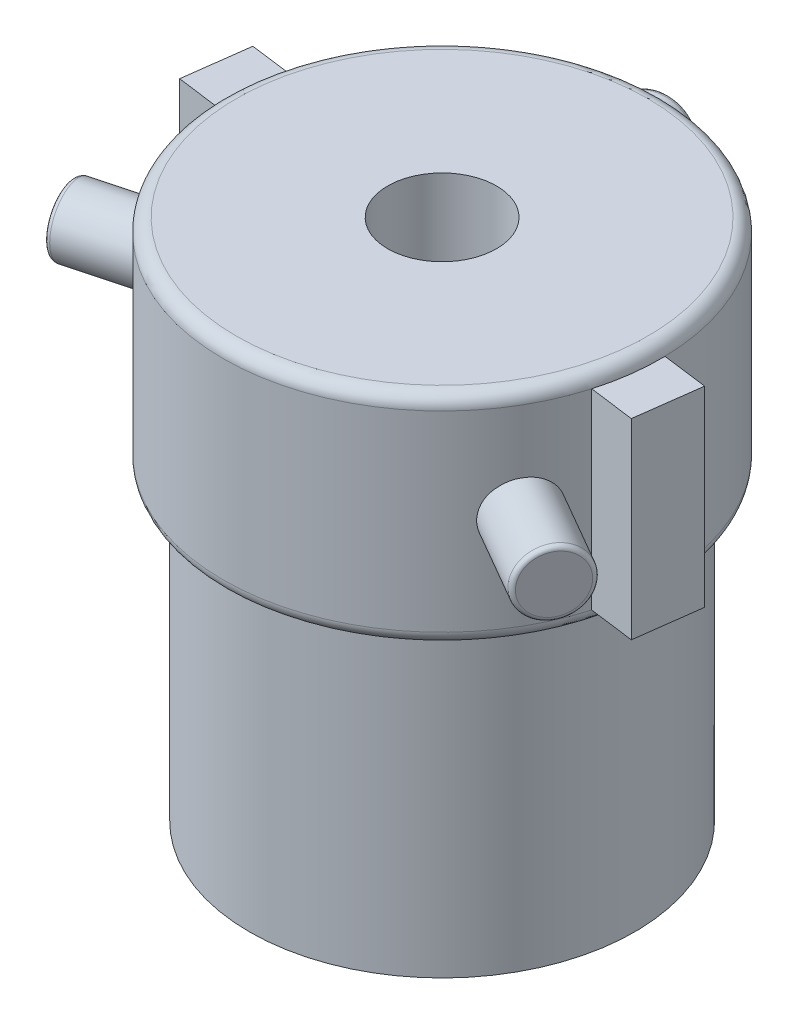
from build123d import *

# Parameters (mm, degrees)
SKETCH1_R                = 44.25
BOSS_EXTRUDE1_DEPTH      = 70
SKETCH2_R                = 50.25
BOSS_EXTRUDE2_DEPTH      = 50
SKETCH3_R                = 12.5
CUT_EXTRUDE1_DEPTH       = 120
FILLET1_R                = 3
FILLET2_R                = 3
BOSS_EXTRUDE3_DEPTH      = 20
BOSS_EXTRUDE3_DEPTH_BACK = 3
SKETCH5_R                = 7.5
CIRPATTERN2_COUNT        = 2
CIRPATTERN2_ANGLE        = 135
BOSS_EXTRUDE7_DEPTH      = 20
BOSS_EXTRUDE7_DEPTH_BACK = 3
SKETCH9_R                = 7.5
FILLET4_R                = 1
FILLET5_R                = 1
FILLET6_R                = 1
BOSS_EXTRUDE8_DEPTH      = 10
BOSS_EXTRUDE8_DEPTH_BACK = 10
SKETCH10_W               = 15
SKETCH10_H               = 44
BOSS_EXTRUDE9_DEPTH      = 10
BOSS_EXTRUDE9_DEPTH_BACK = 10
SKETCH11_W               = 15
SKETCH11_H               = 44
CIRPATTERN4_COUNT        = 2
CIRPATTERN4_ANGLE        = 135


with BuildPart() as part:
    # Sketch1 → Boss-Extrude1 (new body)
    with BuildSketch(Plane(origin=(0, 0, 0), x_dir=(1, 0, 0), z_dir=(0, 1, 0))):
        with Locations(Location((0, 0, 0), (0, 0, 270))):
            Circle(SKETCH1_R)
    extrude(amount=BOSS_EXTRUDE1_DEPTH)

    # Sketch2 → Boss-Extrude2 (add)
    with BuildSketch(Plane(origin=(0, 70, 0), x_dir=(1, 0, 0), z_dir=(0, 1, 0))):
        with Locations(Location((0, 0, 0), (0, 0, 270))):
            Circle(SKETCH2_R)
    extrude(amount=BOSS_EXTRUDE2_DEPTH)

    # Sketch3 → Cut-Extrude1 (cut)
    with BuildSketch(Plane(origin=(0, 120, 0), x_dir=(1, 0, 0), z_dir=(0, 1, 0))):
        with Locations(Location((0, 0, 0), (0, 0, 270))):
            Circle(SKETCH3_R)
    extrude(amount=-CUT_EXTRUDE1_DEPTH, mode=Mode.SUBTRACT)

    # Fillet1
    fillet1_edges = [part.edges().sort_by_distance(p)[0] for p in [
        (0, 120, -50.25),
    ]]
    fillet(fillet1_edges, radius=FILLET1_R)

    # Fillet2
    fillet2_edges = [part.edges().sort_by_distance(p)[0] for p in [
        (0, 70, -50.25),
    ]]
    fillet(fillet2_edges, radius=FILLET2_R)

    # Sketch9 → Boss-Extrude7 (add, two sides: drawn at the far end of the back side and taken through both)
    with BuildSketch(Plane(origin=(-43.51777654, 0, -25.125), x_dir=(-0.4999999999999689, 0, 0.8660254037844567), z_dir=(-0.8660254037844567, 0, -0.4999999999999689)).offset(-BOSS_EXTRUDE7_DEPTH_BACK)):
        with Locations(Location((0, 95, 0), (0, 0, 180))):
            Circle(SKETCH9_R)
    extrude(amount=BOSS_EXTRUDE7_DEPTH + BOSS_EXTRUDE7_DEPTH_BACK)

    # Fillet4
    fillet4_edges = [part.edges().sort_by_distance(p)[0] for p in [
        (-64.588284616, 95, -28.629809472),
    ]]
    fillet(fillet4_edges, radius=FILLET4_R)

    # Sketch10 → Boss-Extrude8 (add, two sides: drawn at the far end of the back side and taken through both)
    with BuildSketch(Plane(origin=(-49.820104284, 0, -6.558941159), x_dir=(-0.13052619222005096, 0, 0.9914448613738105), z_dir=(-0.9914448613738105, 0, -0.13052619222005096)).offset(-BOSS_EXTRUDE8_DEPTH_BACK)):
        with Locations((0, 95)):
            Rectangle(SKETCH10_W, SKETCH10_H)
    extrude(amount=BOSS_EXTRUDE8_DEPTH + BOSS_EXTRUDE8_DEPTH_BACK)

    # Sketch11 → Boss-Extrude9 (add, two sides: drawn at the far end of the back side and taken through both)
    with BuildSketch(Plane(origin=(49.820104284, 0, 6.558941159), x_dir=(0.130526192220051, 0, -0.9914448613738105), z_dir=(0.9914448613738105, 0, 0.130526192220051)).offset(-BOSS_EXTRUDE9_DEPTH_BACK)):
        with Locations((0, 95)):
            Rectangle(SKETCH11_W, SKETCH11_H)
    extrude(amount=BOSS_EXTRUDE9_DEPTH + BOSS_EXTRUDE9_DEPTH_BACK)


with BuildPart() as body_2:
    # Sketch5 → Boss-Extrude3 (new, two sides: drawn at the far end of the back side and taken through both)
    with BuildSketch(Plane(origin=(43.51777654, 0, 25.125), x_dir=(0.49999999999999994, 0, -0.8660254037844387), z_dir=(0.8660254037844386, 0, 0.4999999999999999)).offset(-BOSS_EXTRUDE3_DEPTH_BACK)):
        with Locations((0, 95)):
            Circle(SKETCH5_R)
    extrude(amount=BOSS_EXTRUDE3_DEPTH + BOSS_EXTRUDE3_DEPTH_BACK)


with BuildPart() as cirpattern2_1:
    # CirPattern2: pattern copy
    add(body_2.part.rotate(Axis((0, 120, 0), (0, -1, 0)), 1 * CIRPATTERN2_ANGLE / (CIRPATTERN2_COUNT - 1)))

    # Fillet5
    fillet5_edges = [cirpattern2_1.edges().sort_by_distance(p)[0] for p in [
        (-69.797432135, 95, 10.937594221),
    ]]
    fillet(fillet5_edges, radius=FILLET5_R)


with BuildPart() as body_2_1:
    add(body_2.part)

    # Fillet6
    fillet6_edges = [body_2_1.edges().sort_by_distance(p)[0] for p in [
        (57.088284616, 95, 41.620190528),
    ]]
    fillet(fillet6_edges, radius=FILLET6_R)


with BuildPart() as cirpattern4_1:
    # CirPattern4: pattern copy
    add(body_2_1.part.rotate(Axis((0, 120, 0), (0, 1, 0)), 1 * CIRPATTERN4_ANGLE / (CIRPATTERN4_COUNT - 1)))


solid = Compound([part.part, cirpattern2_1.part, body_2_1.part, cirpattern4_1.part])
